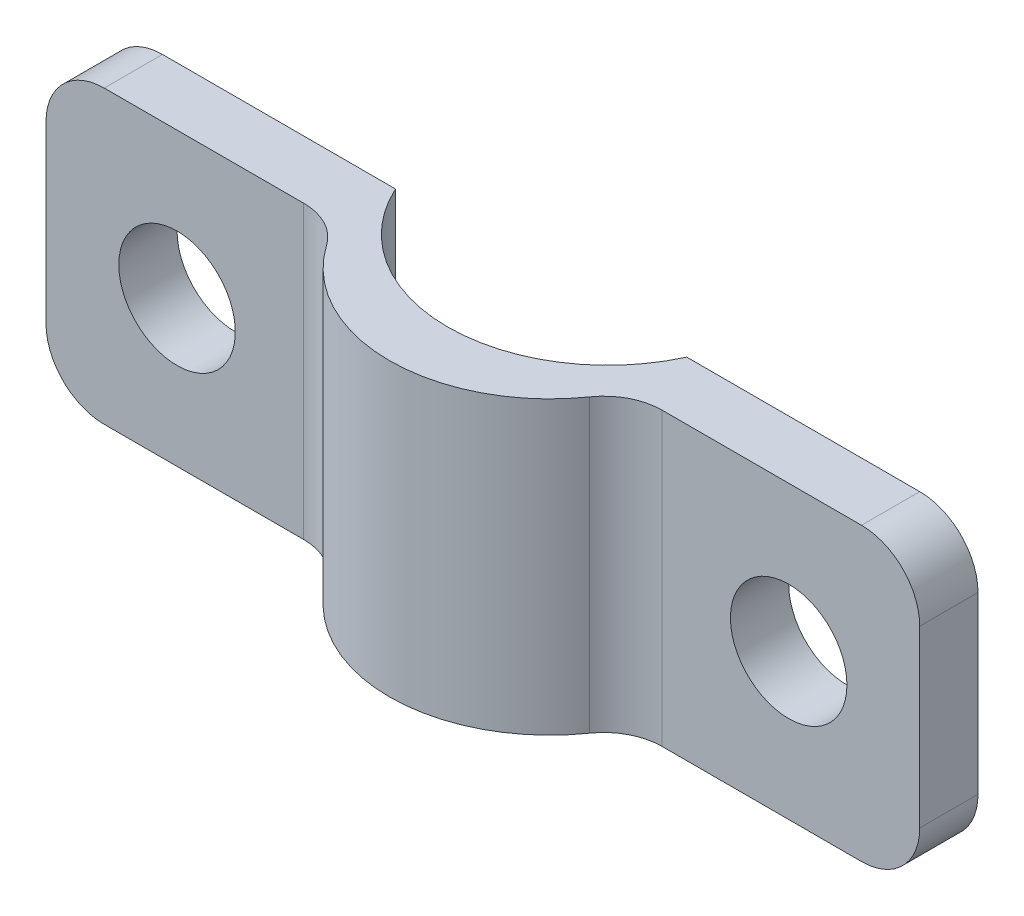
from build123d import *

# Parameters (mm, degrees)
BOSS_EXTRUDE1_DEPTH   = 10
FILLET1_R             = 2
FILLET2_R             = 2
F_4_0MM_DOWEL_HOLE1_D = 4


with BuildPart() as part:
    # Sketch1 → Boss-Extrude1 (new body)
    with BuildSketch(Plane(origin=(0, 0, 0), x_dir=(1, 0, 0), z_dir=(0, 1, 0))):
        with BuildLine():
            Line((-15, -2), (-5, -2))
            ThreePointArc((-5, -2), (0, -5.208712153), (5, -2))
            Line((5, -2), (15, -2))
            Line((15, -2), (15, 0))
            Line((15, 0), (5, 0))
            ThreePointArc((5, 0), (0, -3.208712153), (-5, 0))
            Line((-5, 0), (-15, 0))
            Line((-15, 0), (-15, -2))
        make_face()
    extrude(amount=BOSS_EXTRUDE1_DEPTH)

    # Fillet1
    fillet1_edges = [part.edges().sort_by_distance(p)[0] for p in [
        (5, 5, 2),
        (-5, 5, 2),
    ]]
    fillet(fillet1_edges, radius=FILLET1_R)

    # Fillet2
    fillet2_edges = [part.edges().sort_by_distance(p)[0] for p in [
        (15, 0, 1),
        (15, 10, 1),
        (-15, 10, 1),
        (-15, 0, 1),
    ]]
    fillet(fillet2_edges, radius=FILLET2_R)

    # Ø4.0mm Dowel Hole1 (through all)
    with Locations(Plane(origin=(0, 0, 0), x_dir=(1, 0, 0), z_dir=(0, 0, -1))):
        with Locations((10.5, -5), (-10.5, -5)):
            Hole(F_4_0MM_DOWEL_HOLE1_D / 2)


solid = part.part
